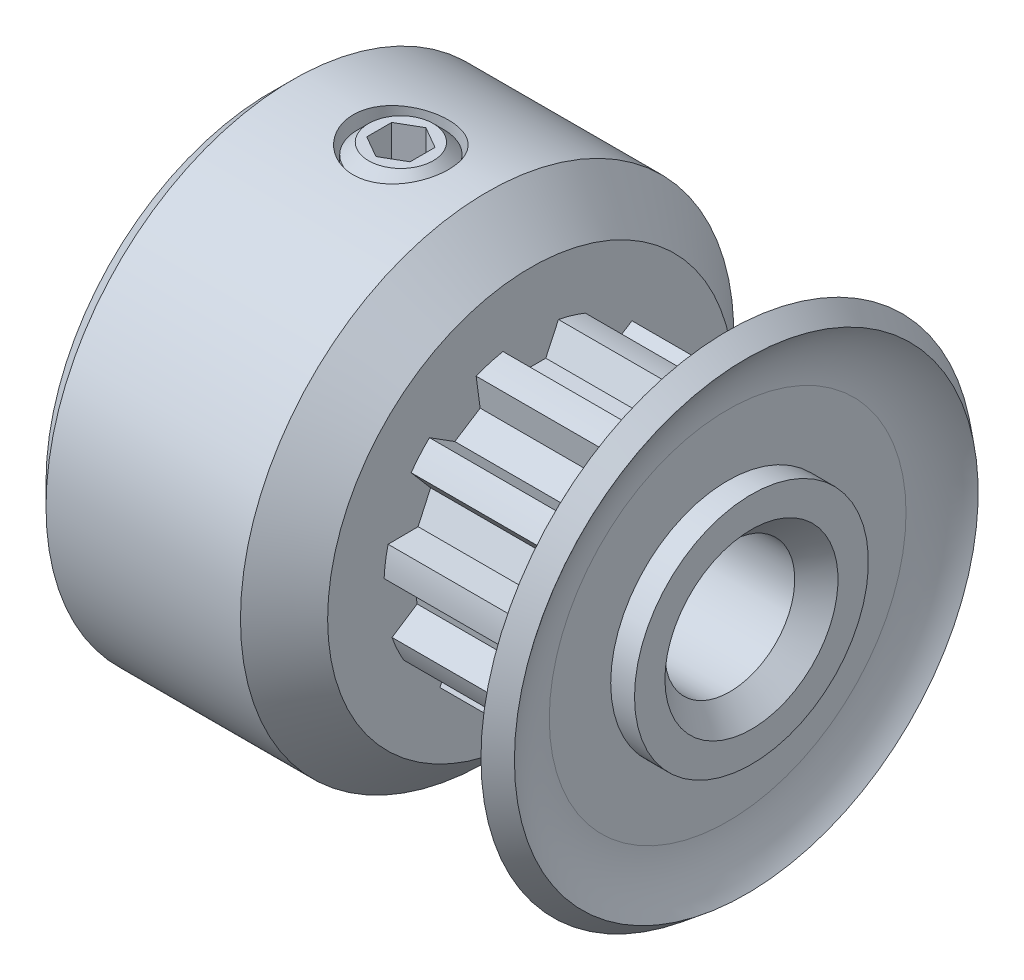
from build123d import *

# Parameters (mm, degrees)
SKETCH4_R          = 3.55
SKETCH4_R_2        = 3.39125
CUT_EXTRUDE2_DEPTH = 4
CUT_EXTRUDE1_DEPTH = 4
CIRPATTERN1_COUNT  = 11
SKETCH6_R          = 1.1
CUT_EXTRUDE3_DEPTH = 10.786853427
CUT_EXTRUDE4_DEPTH = 1.016
CHAMFER1_SIZE      = 0.5


with BuildPart() as part:
    # Sketch1 → Revolve1 (revolve)
    with BuildSketch(Plane.XY, mode=Mode.PRIVATE) as revolve1_sk:
        with BuildLine():
            Line((-5.55, 1.5), (5.55, 1.5))
            Line((5.55, 1.5), (5.55, 5.7))
            Line((5.55, 5.7), (5, 5.7))
            ThreePointArc((5, 5.7), (4.591437689, 4.957287391), (4.45, 4.1215))
            Line((4.45, 4.1215), (4.45, 3.55))
            Line((4.45, 3.55), (0.45, 3.55))
            Line((0.45, 3.55), (0.45, 4.693))
            Line((0.45, 4.693), (-0.557, 5.7))
            Line((-0.557, 5.7), (-5.55, 5.7))
            Line((-5.55, 5.7), (-5.55, 1.5))
        make_face()
    revolve(revolve1_sk.sketch.rotate(Axis((-5.55, 0, 0), (1, 0, 0)), 90), axis=Axis((-5.55, 0, 0), (1, 0, 0)))

    # Sketch4 → Cut-Extrude2 (cut)
    with BuildSketch(Plane(origin=(0.45, 0, 0), x_dir=(0, 0, -1), z_dir=(1, 0, 0))):
        Circle(SKETCH4_R)
        Circle(SKETCH4_R_2, mode=Mode.SUBTRACT)
    extrude(amount=CUT_EXTRUDE2_DEPTH, mode=Mode.SUBTRACT)

    # Sketch3 → Cut-Extrude1 (cut)
    with BuildSketch(Plane(origin=(0.45, 0, 0), x_dir=(0, 0, -1), z_dir=(1, 0, 0))):
        with BuildLine():
            Line((-0.64078492, 3.330160844), (-0.347956913, 2.702189156))
            Line((-0.347956913, 2.702189156), (0.347956913, 2.702189156))
            Line((0.347956913, 2.702189156), (0.64078492, 3.330160844))
            ThreePointArc((0.64078492, 3.330160844), (0, 3.39125), (-0.64078492, 3.330160844))
        make_face()
    cut_extrude1 = extrude(amount=CUT_EXTRUDE1_DEPTH, mode=Mode.SUBTRACT)

    # CirPattern1: Cut-Extrude1 ×11 about axis
    cirpattern1_axis = Axis((0, 0, 0), (1, 0, 0))
    for i in range(1, CIRPATTERN1_COUNT):
        add(cut_extrude1.rotate(cirpattern1_axis, i * 360 / CIRPATTERN1_COUNT), mode=Mode.SUBTRACT)

    # Sketch6 → Cut-Extrude3 (cut, through all)
    with BuildSketch(Plane(origin=(0, 0, 0), x_dir=(1, 0, 0), z_dir=(0, 1, 0))):
        with Locations(Location((-2.55, 0, 0), (0, 0, 90))):
            Circle(SKETCH6_R)
    extrude(amount=CUT_EXTRUDE3_DEPTH, mode=Mode.SUBTRACT)

    # Chamfer1
    chamfer1_edges = [part.edges().sort_by_distance(p)[0] for p in [
        (-5.55, 0, -5.7),
        (-5.55, 0, -1.5),
        (5.55, 0, -1.5),
    ]]
    chamfer(chamfer1_edges, length=CHAMFER1_SIZE)

    # Sketch9 → Cut-Revolve1 (revolve, cut)
    with BuildSketch(Plane.XY, mode=Mode.PRIVATE) as cut_revolve1_sk:
        with BuildLine():
            Line((5.55, 2.702189156), (5.55, 5.7))
            Line((5.55, 5.7), (5.212389964, 5.967777862))
            Line((5.212389964, 5.967777862), (5, 5.7))
            Line((5, 5.7), (5.430912427, 5.358218666))
            ThreePointArc((5.430912427, 5.358218666), (5.110813196, 4.776320315), (5, 4.1215))
            Line((5, 4.1215), (5, 2.702189156))
            Line((5, 2.702189156), (5.55, 2.702189156))
        make_face()
    revolve(cut_revolve1_sk.sketch.rotate(Axis((-5.55, 0, 0), (1, 0, 0)), 90), axis=Axis((-5.55, 0, 0), (1, 0, 0)), mode=Mode.SUBTRACT)


with BuildPart() as body_2:
    # Sketch7 → Revolve2 (revolve)
    with BuildSketch(Plane.XY, mode=Mode.PRIVATE) as revolve2_sk:
        Polygon((-3.296, 5.7), (-2.55, 5.7), (-2.55, 1.881), (-3.296, 1.881), (-3.55, 2.135), (-3.55, 5.446), align=None)
    revolve(revolve2_sk.sketch.rotate(Axis((-2.55, 1.881, 0), (0, 1, 0)), 270), axis=Axis((-2.55, 1.881, 0), (0, 1, 0)))

    # Sketch8 → Cut-Extrude4 (cut)
    with BuildSketch(Plane(origin=(0, 5.7, 0), x_dir=(1, 0, 0), z_dir=(0, 1, 0))):
        Polygon((-2.55, 0.577350269), (-3.05, 0.288675135), (-3.05, -0.288675135), (-2.55, -0.577350269), (-2.05, -0.288675135), (-2.05, 0.288675135), align=None)
    extrude(amount=-CUT_EXTRUDE4_DEPTH, mode=Mode.SUBTRACT)


solid = Compound([part.part, body_2.part])
